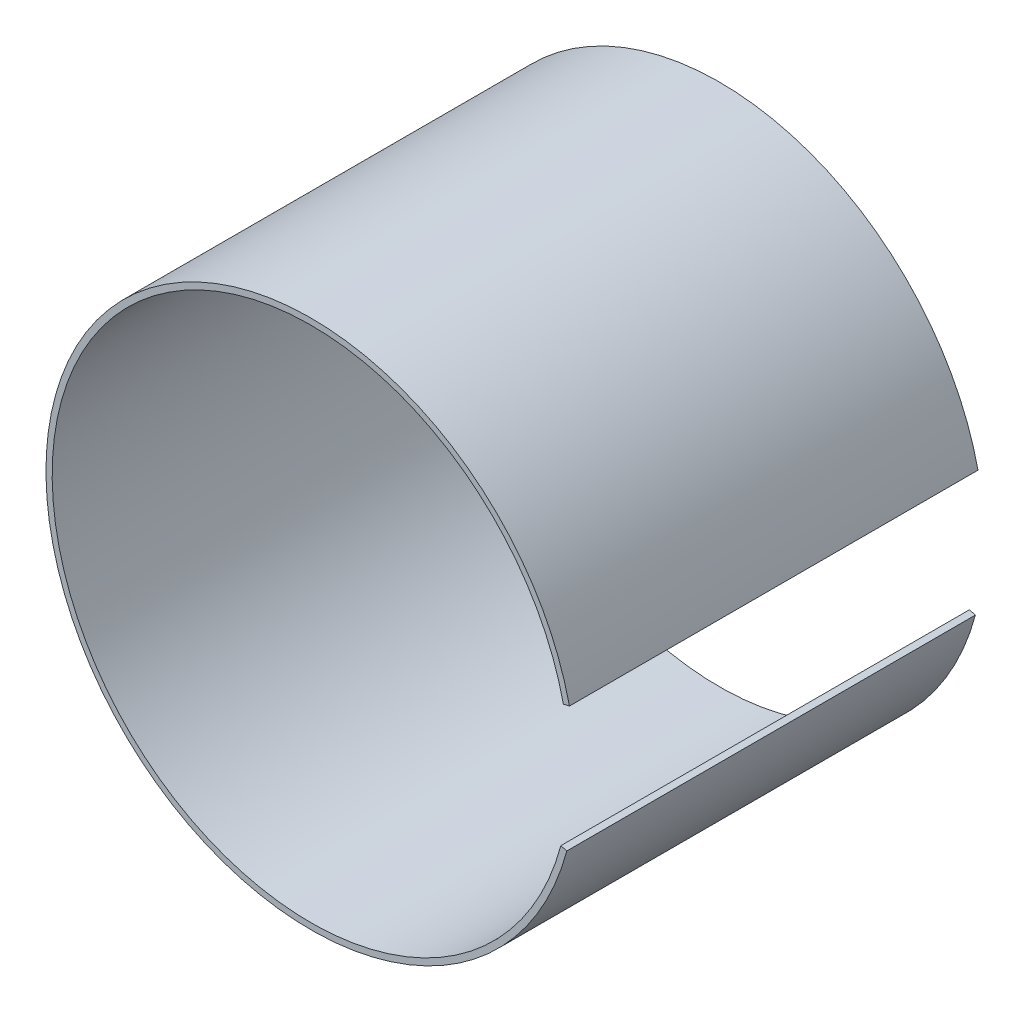
from build123d import *

# Parameters (mm, degrees)
EXTRUDE_THIN1_DEPTH = 33


with BuildPart() as part:
    # Sketch1 → Extrude-Thin1 (new body)
    with BuildSketch(Plane.XY):
        with BuildLine():
            ThreePointArc((20.39105175, 4.584212969), (-20.895612492, 0.428227267), (20.186115298, -5.415787031))
            Line((20.186115298, -5.415787031), (20.669036717, -5.545351314))
            ThreePointArc((20.669036717, -5.545351314), (-21.395507527, 0.438471939), (20.878875954, 4.693883135))
            Line((20.878875954, 4.693883135), (20.39105175, 4.584212969))
        make_face()
    extrude(amount=EXTRUDE_THIN1_DEPTH)


solid = part.part
